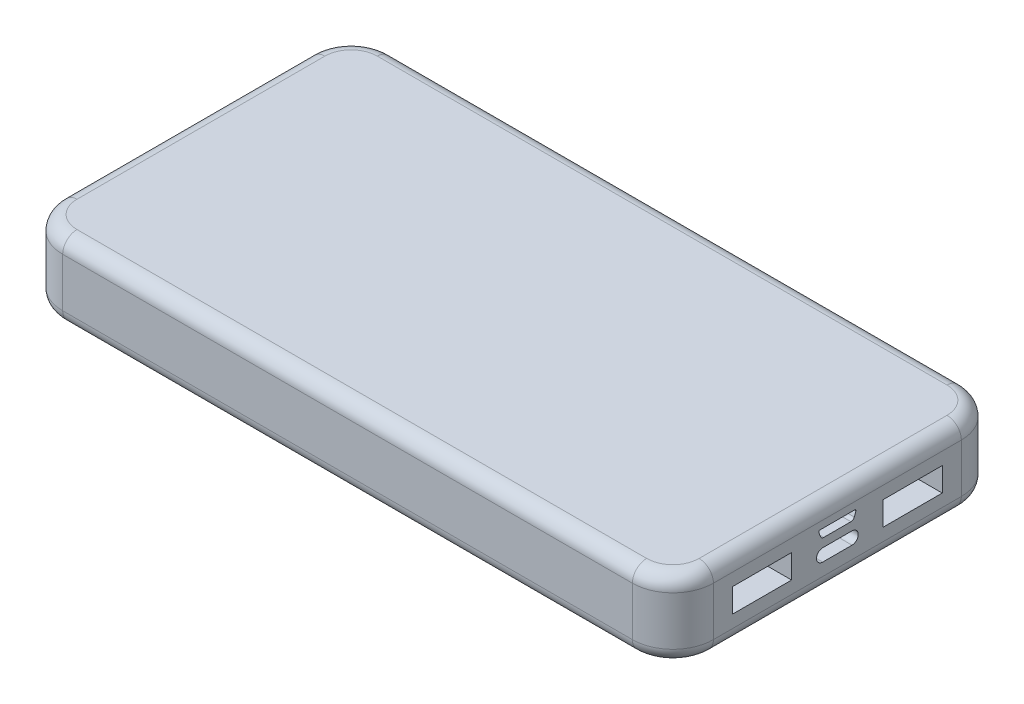
from build123d import *

# Parameters (mm, degrees)
SKETCH1_W           = 136.5
SKETCH1_H           = 69
BOSS_EXTRUDE1_DEPTH = 16.25
FILLET1_R           = 8.5
FILLET2_R           = 3
SKETCH2_W           = 12.4
SKETCH2_H           = 5
CUT_EXTRUDE1_DEPTH  = 12
CUT_EXTRUDE2_DEPTH  = 5
CUT_EXTRUDE3_DEPTH  = 4


with BuildPart() as part:
    # Sketch1 → Boss-Extrude1 (new body)
    with BuildSketch(Plane(origin=(0, 0, 0), x_dir=(1, 0, 0), z_dir=(0, 1, 0))):
        with Locations((68.25, -34.5)):
            Rectangle(SKETCH1_W, SKETCH1_H)
    extrude(amount=BOSS_EXTRUDE1_DEPTH)

    # Fillet1
    fillet1_edges = [part.edges().sort_by_distance(p)[0] for p in [
        (0, 8.125, 0),
        (136.5, 8.125, 0),
        (136.5, 8.125, 69),
        (0, 8.125, 69),
    ]]
    fillet(fillet1_edges, radius=FILLET1_R)

    # Fillet2
    fillet2_edges = [part.edges().sort_by_distance(p)[0] for p in [
        (0, 0, 34.5),
        (0, 16.25, 34.5),
        (68.25, 0, 0),
        (136.5, 0, 34.5),
        (68.25, 0, 69),
        (134.01040764, 0, 66.51040764),
        (134.01040764, 0, 2.48959236),
        (2.48959236, 0, 66.51040764),
        (2.48959236, 0, 2.48959236),
        (68.25, 16.25, 0),
        (68.25, 16.25, 69),
        (136.5, 16.25, 34.5),
        (134.01040764, 16.25, 66.51040764),
        (134.01040764, 16.25, 2.48959236),
        (2.48959236, 16.25, 66.51040764),
        (2.48959236, 16.25, 2.48959236),
    ]]
    fillet(fillet2_edges, radius=FILLET2_R)

    # Sketch2 → Cut-Extrude1 (cut)
    with BuildSketch(Plane(origin=(136.5, 0, 0), x_dir=(0, 0, -1), z_dir=(1, 0, 0))):
        with Locations((-18.7, 8.125)):
            Rectangle(SKETCH2_W, SKETCH2_H)
        with Locations((-50.3, 8.125)):
            Rectangle(SKETCH2_W, SKETCH2_H)
    extrude(amount=-CUT_EXTRUDE1_DEPTH, mode=Mode.SUBTRACT)

    # Sketch3 → Cut-Extrude2 (cut)
    with BuildSketch(Plane(origin=(136.5, 0, 0), x_dir=(0, 0, -1), z_dir=(1, 0, 0))):
        with BuildLine():
            Line((-37.575, 5.625), (-31.425, 5.625))
            ThreePointArc((-31.425, 5.625), (-30.125, 6.925), (-31.425, 8.225))
            Line((-31.425, 8.225), (-37.575, 8.225))
            ThreePointArc((-37.575, 8.225), (-38.875, 6.925), (-37.575, 5.625))
        make_face()
    extrude(amount=-CUT_EXTRUDE2_DEPTH, mode=Mode.SUBTRACT)

    # Sketch4 → Cut-Extrude3 (cut)
    with BuildSketch(Plane(origin=(136.5, 0, 0), x_dir=(0, 0, -1), z_dir=(1, 0, 0))):
        with BuildLine():
            Line((-37.344933438, 10), (-31.655066562, 10))
            ThreePointArc((-31.655066562, 10), (-31.224884235, 10.135635967), (-30.950297096, 10.493484893))
            Line((-30.950297096, 10.493484893), (-30.615076845, 11.414494964))
            ThreePointArc((-30.615076845, 11.414494964), (-30.645211989, 11.643394109), (-30.85, 11.75))
            Line((-30.85, 11.75), (-38.15, 11.75))
            ThreePointArc((-38.15, 11.75), (-38.354788011, 11.643394109), (-38.384923155, 11.414494964))
            Line((-38.384923155, 11.414494964), (-38.049702904, 10.493484893))
            ThreePointArc((-38.049702904, 10.493484893), (-37.775115765, 10.135635967), (-37.344933438, 10))
        make_face()
    extrude(amount=-CUT_EXTRUDE3_DEPTH, mode=Mode.SUBTRACT)


solid = part.part
